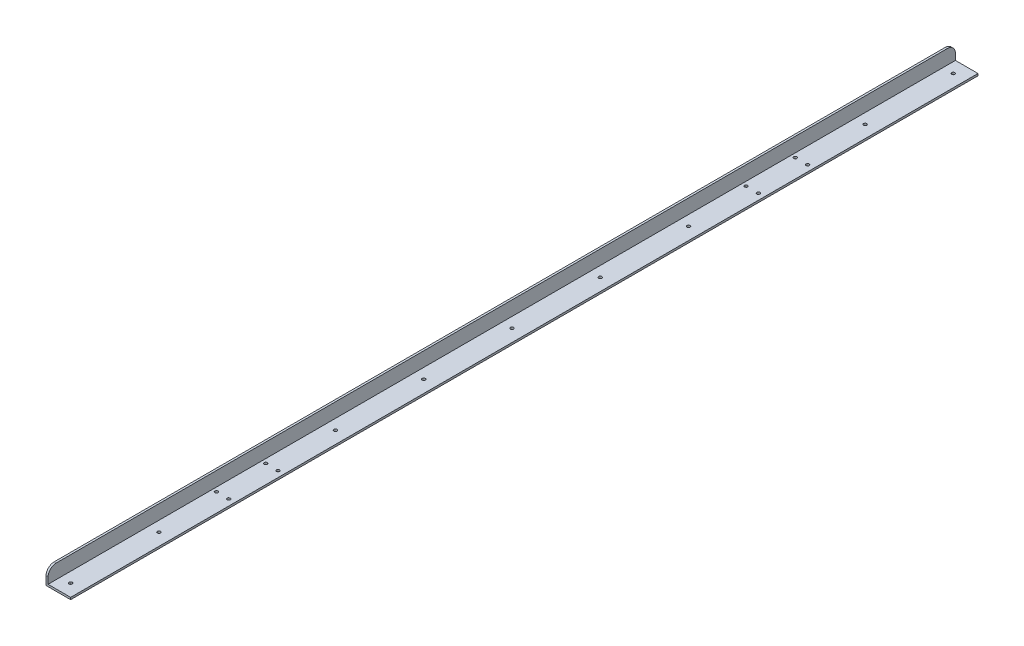
from build123d import *

# Parameters (mm, degrees)
EXTRUDE1_DEPTH     = 1403.35
SKETCH2_R          = 2.3876
SKETCH2_R_2        = 2.4257
CUT_EXTRUDE1_DEPTH = 1405.096860085
FILLET1_R          = 12.7


with BuildPart() as part:
    # Sketch1 → Extrude1 (new body)
    with BuildSketch(Plane.XY):
        Polygon((0, 0), (38.1, 0), (38.1, 3.175), (3.175, 3.175), (3.175, 25.4), (0, 25.4), align=None)
    extrude(amount=-EXTRUDE1_DEPTH)

    # Sketch2 → Cut-Extrude1 (cut, through all)
    with BuildSketch(Plane(origin=(0, 0, 0), x_dir=(1, 0, 0), z_dir=(0, 1, 0))):
        with Locations(Location((9.525, 254, 0), (0, 0, 180))):
            Circle(SKETCH2_R)
        with Locations(Location((28.575, 254, 0), (0, 0, 180))):
            Circle(SKETCH2_R)
        with Locations(Location((9.525, 1073.15, 0), (0, 0, 180))):
            Circle(SKETCH2_R)
        with Locations(Location((28.575, 1073.15, 0), (0, 0, 180))):
            Circle(SKETCH2_R)
        with Locations(Location((19.05, 19.05, 0), (0, 0, 180))):
            Circle(SKETCH2_R_2)
        with Locations(Location((19.05, 155.575, 0), (0, 0, 180))):
            Circle(SKETCH2_R_2)
        with Locations(Location((19.05, 428.625, 0), (0, 0, 180))):
            Circle(SKETCH2_R_2)
        with Locations(Location((19.05, 565.15, 0), (0, 0, 180))):
            Circle(SKETCH2_R_2)
        with Locations(Location((19.05, 701.675, 0), (0, 0, 180))):
            Circle(SKETCH2_R_2)
        with Locations(Location((19.05, 838.2, 0), (0, 0, 180))):
            Circle(SKETCH2_R_2)
        with Locations(Location((19.05, 974.725, 0), (0, 0, 180))):
            Circle(SKETCH2_R_2)
        with Locations(Location((19.05, 1247.775, 0), (0, 0, 180))):
            Circle(SKETCH2_R_2)
        with Locations(Location((19.05, 1384.3, 0), (0, 0, 180))):
            Circle(SKETCH2_R_2)
        with Locations(Location((28.575, 330.2, 0), (0, 0, 180))):
            Circle(SKETCH2_R)
        with Locations(Location((9.525, 330.2, 0), (0, 0, 180))):
            Circle(SKETCH2_R)
        with Locations(Location((28.575, 1149.35, 0), (0, 0, 180))):
            Circle(SKETCH2_R)
        with Locations(Location((9.525, 1149.35, 0), (0, 0, 180))):
            Circle(SKETCH2_R)
    extrude(amount=CUT_EXTRUDE1_DEPTH, mode=Mode.SUBTRACT)

    # Fillet1
    fillet1_edges = [part.edges().sort_by_distance(p)[0] for p in [
        (1.5875, 25.4, -1403.35),
        (1.5875, 25.4, 0),
    ]]
    fillet(fillet1_edges, radius=FILLET1_R)


solid = part.part
